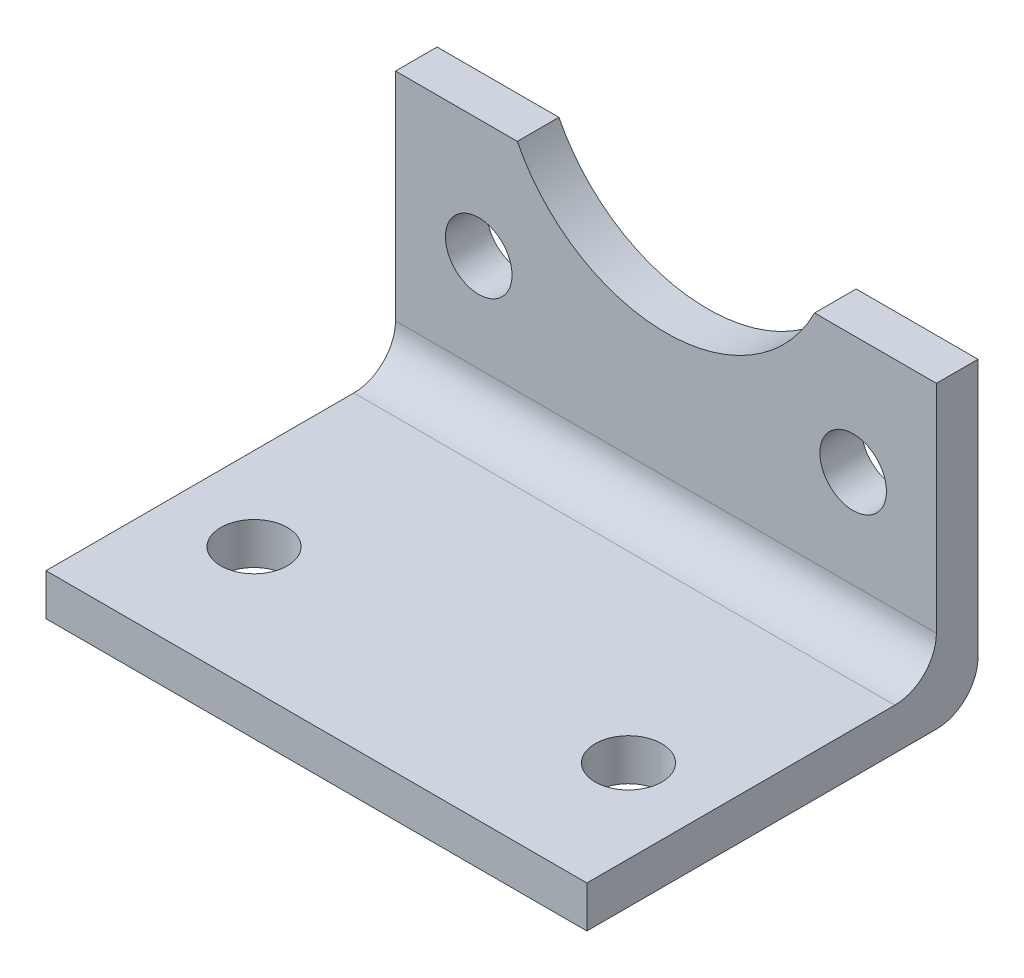
from build123d import *

# Parameters (mm, degrees)
SZKIC1_R                    = 4
DODANIE_WYCI_GNI_CIE1_DEPTH = 5
SZKIC2_W                    = 65
SZKIC2_H                    = 47
SZKIC2_R                    = 4
DODANIE_WYCI_GNI_CIE2_DEPTH = 5
ZAOKR_GLENIE1_R             = 5
ZAOKR_GLENIE2_R             = 5


with BuildPart() as part:
    # Szkic1 → Dodanie-wyciągnięcie1 (new body)
    with BuildSketch(Plane.XY):
        with BuildLine():
            Line((17.860571099, 18), (32.5, 18))
            Line((32.5, 18), (32.5, -18))
            Line((32.5, -18), (-32.5, -18))
            Line((-32.5, -18), (-32.5, 18))
            Line((-32.5, 18), (-17.860571099, 18))
            ThreePointArc((-17.860571099, 18), (0, 7), (17.860571099, 18))
        make_face()
        with Locations((-22.5, 3.75)):
            Circle(SZKIC1_R, mode=Mode.SUBTRACT)
        with Locations(Location((22.5, 3.75, 0), (0, 0, 180))):
            Circle(SZKIC1_R, mode=Mode.SUBTRACT)
    extrude(amount=-DODANIE_WYCI_GNI_CIE1_DEPTH)

    # Szkic2 → Dodanie-wyciągnięcie2 (add)
    with BuildSketch(Plane.XZ.offset(18)):
        with Locations((0, 18.5)):
            Rectangle(SZKIC2_W, SZKIC2_H)
        with Locations(Location((-22.5, 27, 0), (0, 0, 270))):
            Circle(SZKIC2_R, mode=Mode.SUBTRACT)
        with Locations(Location((22.5, 27, 0), (0, 0, 90))):
            Circle(SZKIC2_R, mode=Mode.SUBTRACT)
    extrude(amount=-DODANIE_WYCI_GNI_CIE2_DEPTH)

    # Zaokrąglenie1
    zaokr_glenie1_edges = [part.edges().sort_by_distance(p)[0] for p in [
        (0, -13, 0),
    ]]
    fillet(zaokr_glenie1_edges, radius=ZAOKR_GLENIE1_R)

    # Zaokrąglenie2
    zaokr_glenie2_edges = [part.edges().sort_by_distance(p)[0] for p in [
        (0, -18, -5),
    ]]
    fillet(zaokr_glenie2_edges, radius=ZAOKR_GLENIE2_R)


solid = part.part
